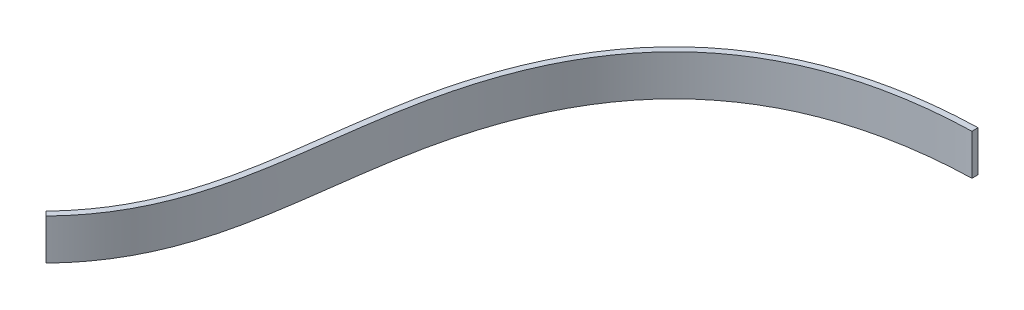
from build123d import *

# Parameters (mm, degrees)
BOSS_EXTRUDE1_DEPTH = 20


with BuildPart() as part:
    # Sketch1 → Boss-Extrude1 (new body)
    with BuildSketch(Plane(origin=(0, 0, 0), x_dir=(1, 0, 0), z_dir=(0, 1, 0))):
        with BuildLine():
            Line((-47.42188237, 36.555608943), (-49.571302883, 38.648451856))
            add(Edge.make_bspline(
                [(143.581495405, 302.648451856), (42.61825181, 299.98113935), (-24.152876062, 186.950138099), (-11.239908737, 78.01609113), (-49.571302883, 38.648451856)],
                knots=[0, 0, 0, 0, 0.513498925, 1, 1, 1, 1], degree=3))
            Line((143.581495405, 302.648451856), (143.660723709, 299.649498226))
            add(Edge.make_bspline(
                [(143.660723709, 299.649498226), (142.157027602, 299.609772606), (139.128494961, 299.50360832), (133.250141821, 299.193093906), (126.113013538, 298.620780731), (117.916080592, 297.650428945), (107.452737018, 295.991619255), (95.233119631, 293.259110657), (81.876402717, 289.005808151), (69.758374327, 283.856984497), (55.159065144, 275.899545458), (39.653979248, 264.089767786), (24.889226379, 247.49579022), (13.460170979, 229.02476214), (4.89713428, 209.247707102), (-1.270204713, 188.749330599), (-5.483803365, 168.174588865), (-8.480589587, 147.725965066), (-11.068870544, 127.541110755), (-14.054373266, 107.777005808), (-17.56237027, 91.784289384), (-21.402861967, 79.360646252), (-24.906929371, 70.252550116), (-29.140195841, 61.381230985), (-33.362593923, 54.21025541), (-37.205995237, 48.623938067), (-40.336741542, 44.509998318), (-43.713794958, 40.489962948), (-46.171626005, 37.83966455), (-47.42188237, 36.555608943)],
                knots=[0, 0, 0, 0, 0.0078125, 0.015625, 0.03125, 0.046875, 0.0625, 0.09375, 0.125, 0.15625, 0.1875, 0.25, 0.3125, 0.375, 0.4375, 0.5, 0.5625, 0.625, 0.6875, 0.75, 0.8125, 0.84375, 0.875, 0.90625, 0.9375, 0.953125, 0.96875, 0.984375, 1, 1, 1, 1], degree=3))
        make_face()
    extrude(amount=BOSS_EXTRUDE1_DEPTH)


solid = part.part
